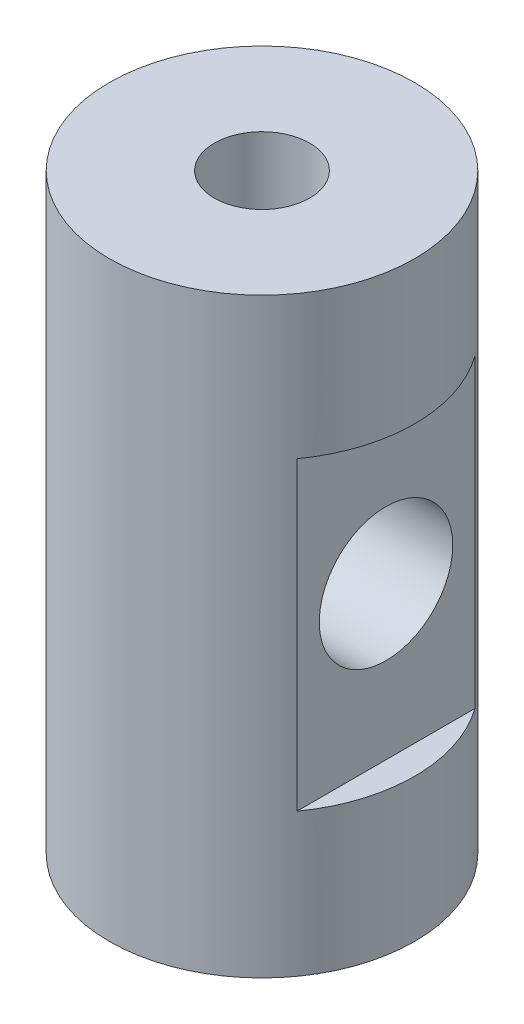
from build123d import *

# Parameters (mm, degrees)
SKETCH_1_R               = 8
EXTRUDE_1_DEPTH          = 31
M6X1_0_1_D               = 5
M6X1_0_1_DEPTH           = 6
M6X1_0_1_TIP             = 1.502151548
M6X1_0_2_D               = 5
M6X1_0_2_DEPTH           = 6
M6X1_0_2_TIP             = 1.502151548
CUT_EXTRUDE_2_DEPTH      = 10
CUT_EXTRUDE_2_DEPTH_BACK = 10
SKETCH_10_W              = 1.5
SKETCH_10_H              = 16
M8X1_0_1_D               = 7


with BuildPart() as part:
    # 草图1 → 凸台-拉伸1 (new body)
    with BuildSketch(Plane(origin=(0, 0, 0), x_dir=(1, 0, 0), z_dir=(0, 1, 0))):
        Circle(SKETCH_1_R)
    extrude(amount=EXTRUDE_1_DEPTH)

    # M6x1.0 螺纹孔1
    with Locations(Plane(origin=(0, 31, 0), x_dir=(1, 0, 0), z_dir=(0, 1, 0))):
        with Locations((0, 0)):
            Hole(M6X1_0_1_D / 2, depth=M6X1_0_1_DEPTH)
            with Locations((0, 0, -(M6X1_0_1_DEPTH + M6X1_0_1_TIP / 2))):  # 118° drill point
                Cone(0, M6X1_0_1_D / 2, M6X1_0_1_TIP, mode=Mode.SUBTRACT)

    # M6x1.0 螺纹孔2
    with Locations(Plane(origin=(0, 0, 0), x_dir=(-1, 0, 0), z_dir=(0, -1, 0))):
        with Locations((0, 0)):
            Hole(M6X1_0_2_D / 2, depth=M6X1_0_2_DEPTH)
            with Locations((0, 0, -(M6X1_0_2_DEPTH + M6X1_0_2_TIP / 2))):  # 118° drill point
                Cone(0, M6X1_0_2_D / 2, M6X1_0_2_TIP, mode=Mode.SUBTRACT)

    # 草图10 → 切除-拉伸2 (cut, two sides: drawn at the far end of the back side and taken through both)
    with BuildSketch(Plane.XY.offset(-CUT_EXTRUDE_2_DEPTH_BACK)):
        with Locations((7.25, 15.5)):
            Rectangle(SKETCH_10_W, SKETCH_10_H)
        with Locations((-7.25, 15.5)):
            Rectangle(SKETCH_10_W, SKETCH_10_H)
    extrude(amount=CUT_EXTRUDE_2_DEPTH + CUT_EXTRUDE_2_DEPTH_BACK, mode=Mode.SUBTRACT)

    # M8x1.0 螺纹孔1 (through all)
    with Locations(Plane(origin=(6.5, 0, 0), x_dir=(0, 0, -1), z_dir=(1, 0, 0))):
        with Locations((0, 15.5)):
            Hole(M8X1_0_1_D / 2)


solid = part.part
